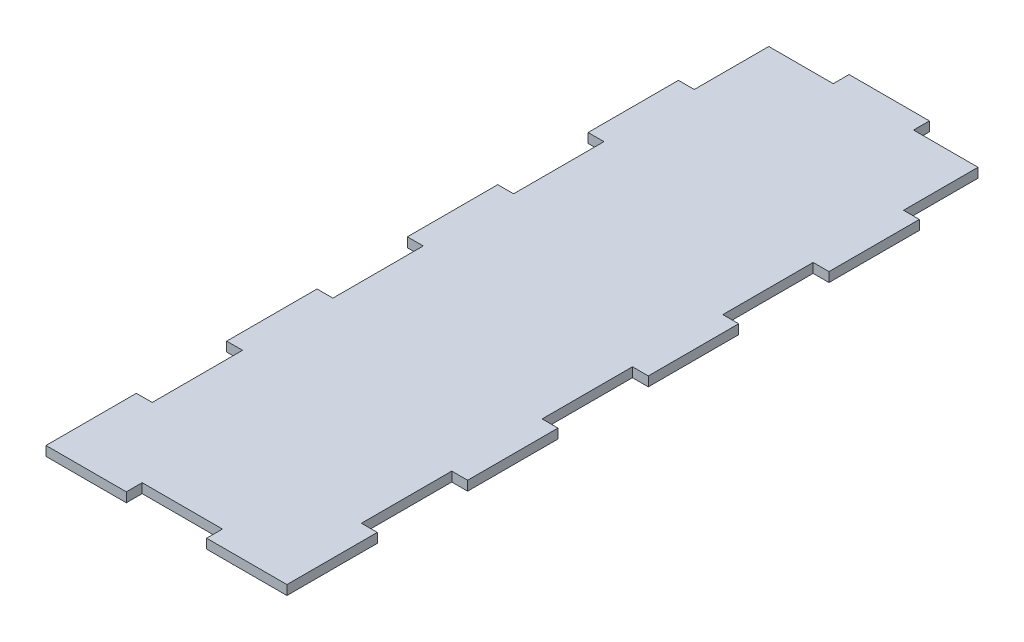
from build123d import *

# Parameters (mm, degrees)
BOSS_EXTRUDE1_DEPTH = 3


with BuildPart() as part:
    # Sketch1 → Boss-Extrude1 (new body)
    with BuildSketch(Plane(origin=(0, 0, 0), x_dir=(1, 0, 0), z_dir=(0, 1, 0))):
        Polygon((-38, -114), (-12.666666667, -114), (-12.666666667, -109), (0, -109), (0, 114), (-12.666666667, 114), (-12.666666667, 109), (-33, 109), (-33, 85.5), (-38, 85.5), (-38, 57), (-33, 57), (-33, 28.5), (-38, 28.5), (-38, 0), (-33, 0), (-33, -28.5), (-38, -28.5), (-38, -57), (-33, -57), (-33, -85.5), (-38, -85.5), align=None)
    boss_extrude1 = extrude(amount=BOSS_EXTRUDE1_DEPTH)

    # Mirror1: Boss-Extrude1 across plane
    add(boss_extrude1.mirror(Plane(origin=(0, 3, 109), x_dir=(0, 0, 1), z_dir=(-1, 0, 0))))


solid = part.part
